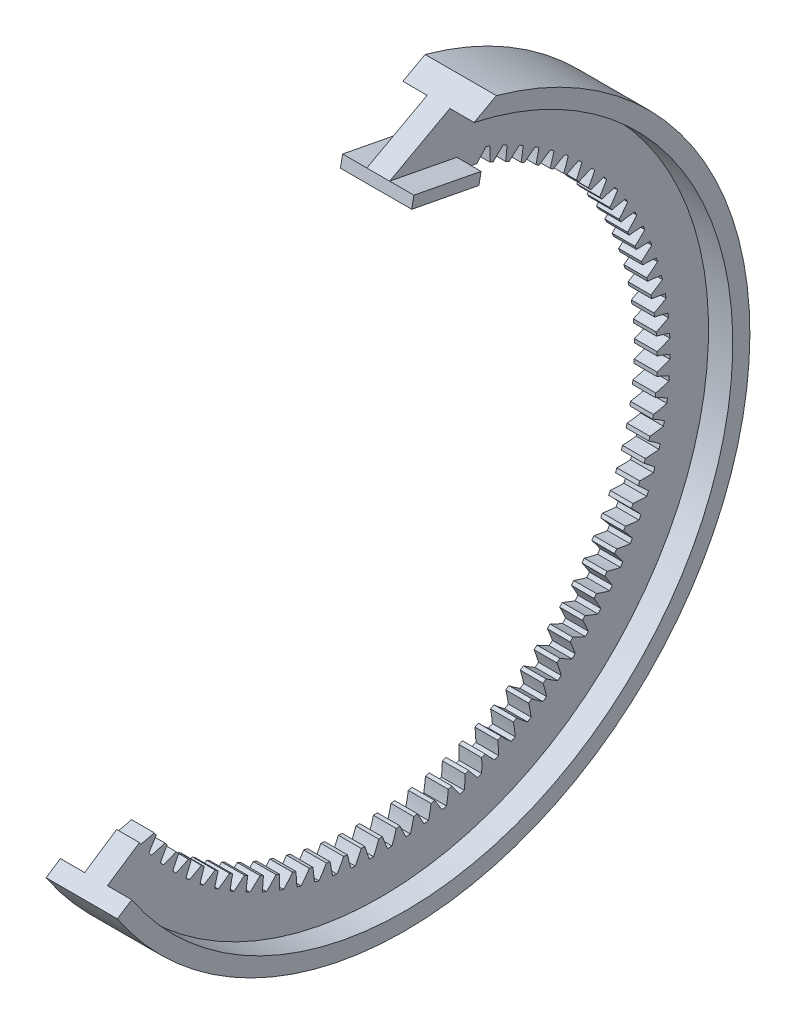
from build123d import *

# Parameters (mm, degrees)
BASPROSKE_W                  = 8
BASPROSKE_H                  = 8
TOOTHCUT_DEPTH               = 149.707767114
TEETHCUTS_COUNT              = 94
TEETHCUTS_ANGLE              = 338.181818182
TAGLIO_ESTRUSIONE1_DEPTH     = 10
ESTRUSIONE_ESTRUSIONE1_START = -8
ESTRUSIONE_ESTRUSIONE1_DEPTH = 8
SCHIZZO3_W                   = 8.5
SCHIZZO3_H                   = 24
ESTRUSIONE_ESTRUSIONE2_DEPTH = 4
RIVOLUZIONE1_ANGLE           = 235
TAGLIO_ESTRUSIONE2_DEPTH     = 25


with BuildPart() as part:
    # BasProSke → Base-Revolve (revolve)
    with BuildSketch(Plane(origin=(0, 0, 0), x_dir=(1, 0, 0), z_dir=(0, 1, 0))):
        with Locations((4, 101)):
            Rectangle(BASPROSKE_W, BASPROSKE_H)
    revolve(axis=Axis((-10, 0, 0), (1, 0, 0)))

    # TooCutSke → ToothCut (cut, through all)
    with BuildSketch(Plane(origin=(0, 0, 0), x_dir=(0, 0, -1), z_dir=(1, 0, 0))):
        with BuildLine():
            ThreePointArc((2.416914764, 96.944476729), (1.6457634, 99.24154855), (0.763126396, 101.49813121))
            ThreePointArc((0.763126396, 101.49813121), (0, 101.501), (-0.763126396, 101.49813121))
            ThreePointArc((-0.763126396, 101.49813121), (-1.6457634, 99.24154855), (-2.416914764, 96.944476729))
            ThreePointArc((-2.416914764, 96.944476729), (0, 96.9746), (2.416914764, 96.944476729))
        make_face()
    toothcut = extrude(amount=TOOTHCUT_DEPTH, mode=Mode.SUBTRACT)

    # TeethCuts: ToothCut ×94 about axis
    teethcuts_axis = Axis((-10, 0, 0), (1, 0, 0))
    for i in range(1, TEETHCUTS_COUNT):
        add(toothcut.rotate(teethcuts_axis, i * TEETHCUTS_ANGLE / (TEETHCUTS_COUNT - 1)), mode=Mode.SUBTRACT)

    # Schizzo1 → Taglio-Estrusione1 (cut)
    with BuildSketch(Plane(origin=(8, 0, 0), x_dir=(0, 0, -1), z_dir=(1, 0, 0))):
        with BuildLine():
            Line((0, 0), (-87.480141613, -58.070860364))
            ThreePointArc((-87.480141613, -58.070860364), (-91.90331631, 50.781694056), (2.607683897, 104.96761398))
            Line((2.607683897, 104.96761398), (2.409003219, 96.970081486))
            Line((2.409003219, 96.970081486), (0, 0))
        make_face()
    extrude(amount=-TAGLIO_ESTRUSIONE1_DEPTH, mode=Mode.SUBTRACT)

    # Schizzo2 → Estrusione-Estrusione1 (add)
    with BuildSketch(Plane(origin=(8, 0, 0), x_dir=(0, 0, -1), z_dir=(1, 0, 0)).offset(ESTRUSIONE_ESTRUSIONE1_START)):
        with BuildLine():
            Line((2.409003219, 96.970081486), (33.803697271, 90.919250166))
            ThreePointArc((33.803697271, 90.919250166), (18.357370703, 95.247083634), (2.409003219, 96.970081486))
        make_face()
    extrude(amount=ESTRUSIONE_ESTRUSIONE1_DEPTH)

    # Schizzo3 → Estrusione-Estrusione2 (add)
    with BuildSketch(Plane(origin=(0, 93.944665826, -18.106350245), x_dir=(1, 0, 0), z_dir=(0, -0.9819286972627082, 0.1892512443604032))):
        with Locations((-4.25, 3.986239194)):
            Rectangle(SCHIZZO3_W, SCHIZZO3_H)
        with Locations((12.25, 3.986239194)):
            Rectangle(SCHIZZO3_W, SCHIZZO3_H)
    extrude(amount=-ESTRUSIONE_ESTRUSIONE2_DEPTH)

    # Schizzo4 → Rivoluzione1 (revolve)
    with BuildSketch(Plane(origin=(0, 0, 0), x_dir=(1, 0, 0), z_dir=(0, 0.024835084736822544, 0.99969156171597))):
        Polygon((0, 105), (0, 115), (-8.5, 115), (-8.5, 121), (16.5, 121), (16.5, 115), (8, 115), (8, 105), align=None)
    revolve(axis=Axis((-101.907492964, 0, 0), (-1, 0, 0)), revolution_arc=RIVOLUZIONE1_ANGLE)

    # Schizzo5 → Taglio-Estrusione2 (cut)
    with BuildSketch(Plane(origin=(16.5, 0, 0), x_dir=(0, 0, -1), z_dir=(1, 0, 0))):
        with BuildLine():
            Line((3.166008197, 100.897796275), (32.107851095, 116.662272814))
            ThreePointArc((32.107851095, 116.662272814), (17.687629738, 119.700241246), (3.005045253, 120.962678968))
            Line((3.005045253, 120.962678968), (2.409003219, 96.970081486))
            Line((2.409003219, 96.970081486), (3.166008197, 100.897796275))
        make_face()
    extrude(amount=-TAGLIO_ESTRUSIONE2_DEPTH, mode=Mode.SUBTRACT)


solid = part.part
